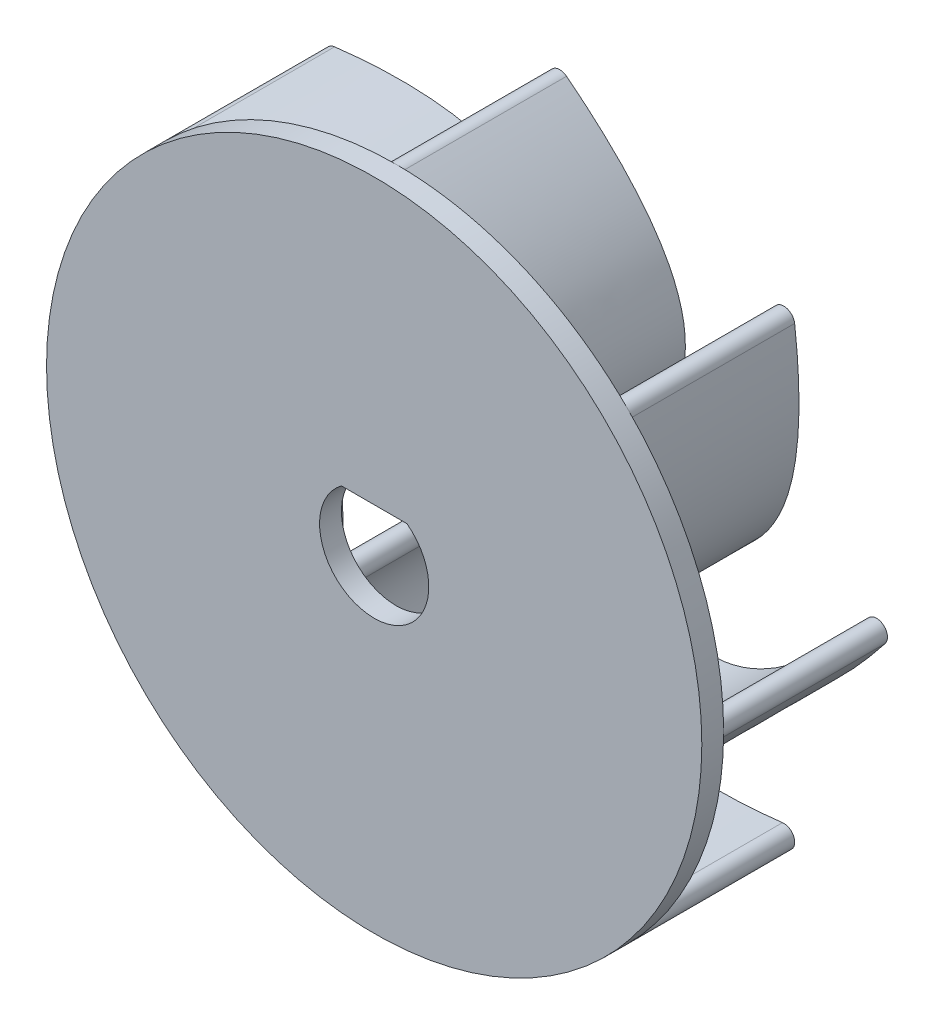
from build123d import *

# Parameters (mm, degrees)
SKETCH_1_R               = 30
EXTRUDE_1_DEPTH          = 2
EXTRUDE_2_DEPTH          = 17
PATTERN_CIRCULAR_1_COUNT = 8


with BuildPart() as part:
    # 草图1 → 凸台-拉伸1 (new body)
    with BuildSketch(Plane.XY):
        Circle(SKETCH_1_R)
        with BuildLine():
            Line((-3, 4), (3, 4))
            ThreePointArc((3, 4), (0, -5), (-3, 4))
        make_face(mode=Mode.SUBTRACT)
    extrude(amount=EXTRUDE_1_DEPTH)

    # 草图2 → 凸台-拉伸2 (add)
    with BuildSketch(Plane.XY.offset(2)):
        with BuildLine():
            ThreePointArc((20.625406451, -21.49895373), (21.49895373, -20.386786858), (20.386786858, -19.513239579))
            add(Edge.make_bspline(
                [(0.965925826, -12.741180955), (1.409497804, -14.382119254), (3.220303095, -16.84907358), (6.509269858, -18.926586642), (13.75866587, -20.299471864), (20.386786858, -19.513239579)],
                knots=[0, 0, 0, 0.1875, 0.375, 0.625, 1, 1, 1], degree=2))
            ThreePointArc((0.965925826, -12.741180955), (-0.258819045, -12.034074174), (-0.965925826, -13.258819045))
            add(Edge.make_bspline(
                [(-0.965925826, -13.258819045), (-0.438926385, -15.240102594), (1.84715244, -18.356470422), (5.852915303, -20.85485807), (13.815097786, -22.327592651), (20.625406451, -21.49895373)],
                knots=[0, 0, 0, 0.1875, 0.375, 0.625, 1, 1, 1], degree=2))
        make_face()
    extrude_2 = extrude(amount=-EXTRUDE_2_DEPTH)

    # 阵列(圆周)1: 凸台-拉伸2 ×8 about axis
    pattern_circular_1_axis = Axis((0, 0, 0), (0, 0, -1))
    for i in range(1, PATTERN_CIRCULAR_1_COUNT):
        add(extrude_2.rotate(pattern_circular_1_axis, i * 360 / PATTERN_CIRCULAR_1_COUNT))


solid = part.part
